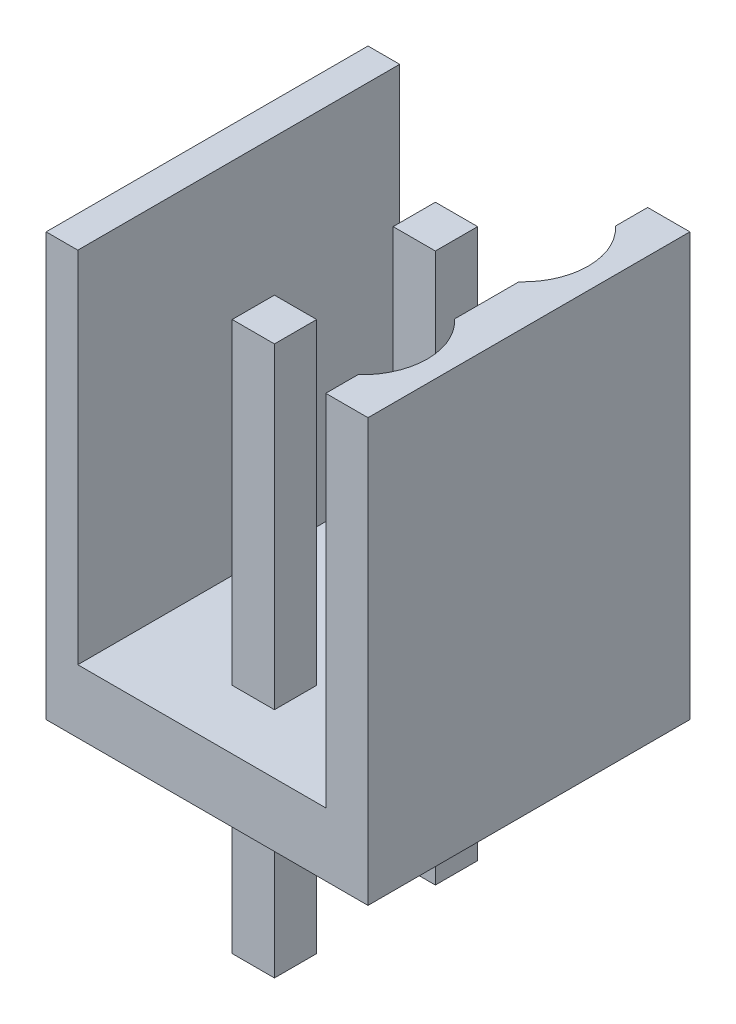
from build123d import *

# Parameters (mm, degrees)
SKETCH_1_W           = 7.62
SKETCH_1_H           = 7.62
EXTRUDE_1_DEPTH      = 10
CUT_EXTRUDE_1_DEPTH  = 8.5
EXTRUDE_2_DEPTH      = 4
EXTRUDE_2_DEPTH_BACK = 9
SKETCH_3_W           = 1
SKETCH_3_H           = 1


with BuildPart() as part:
    # 草图1 → 拉伸1 (new body)
    with BuildSketch(Plane(origin=(0, 0, 0), x_dir=(1, 0, 0), z_dir=(0, 1, 0))):
        Rectangle(SKETCH_1_W, SKETCH_1_H)
    extrude(amount=EXTRUDE_1_DEPTH)

    # 草图2 → 切除-拉伸1 (cut)
    with BuildSketch(Plane(origin=(0, 10, 0), x_dir=(-1, 0, 0), z_dir=(0, 1, 0))):
        with BuildLine():
            Line((-2.81, -3.81), (-2.81, -3.049818304))
            ThreePointArc((-2.81, -3.049818304), (-3.31, -1.905), (-2.81, -0.760181696))
            Line((-2.81, -0.760181696), (-2.81, 0.760181696))
            ThreePointArc((-2.81, 0.760181696), (-3.31, 1.905), (-2.81, 3.049818304))
            Line((-2.81, 3.049818304), (-2.81, 3.81))
            Line((-2.81, 3.81), (3.06, 3.81))
            Line((3.06, 3.81), (3.06, -3.81))
            Line((3.06, -3.81), (-2.81, -3.81))
        make_face()
    extrude(amount=-CUT_EXTRUDE_1_DEPTH, mode=Mode.SUBTRACT)

    # 草图3 → 拉伸2 (add, two sides: drawn at the far end of the back side and taken through both)
    with BuildSketch(Plane.XZ.offset(-EXTRUDE_2_DEPTH_BACK)):
        with Locations((-0.31, 1.905)):
            Rectangle(SKETCH_3_W, SKETCH_3_H)
        with Locations((-0.31, -1.905)):
            Rectangle(SKETCH_3_W, SKETCH_3_H)
    extrude(amount=EXTRUDE_2_DEPTH + EXTRUDE_2_DEPTH_BACK)


solid = part.part
